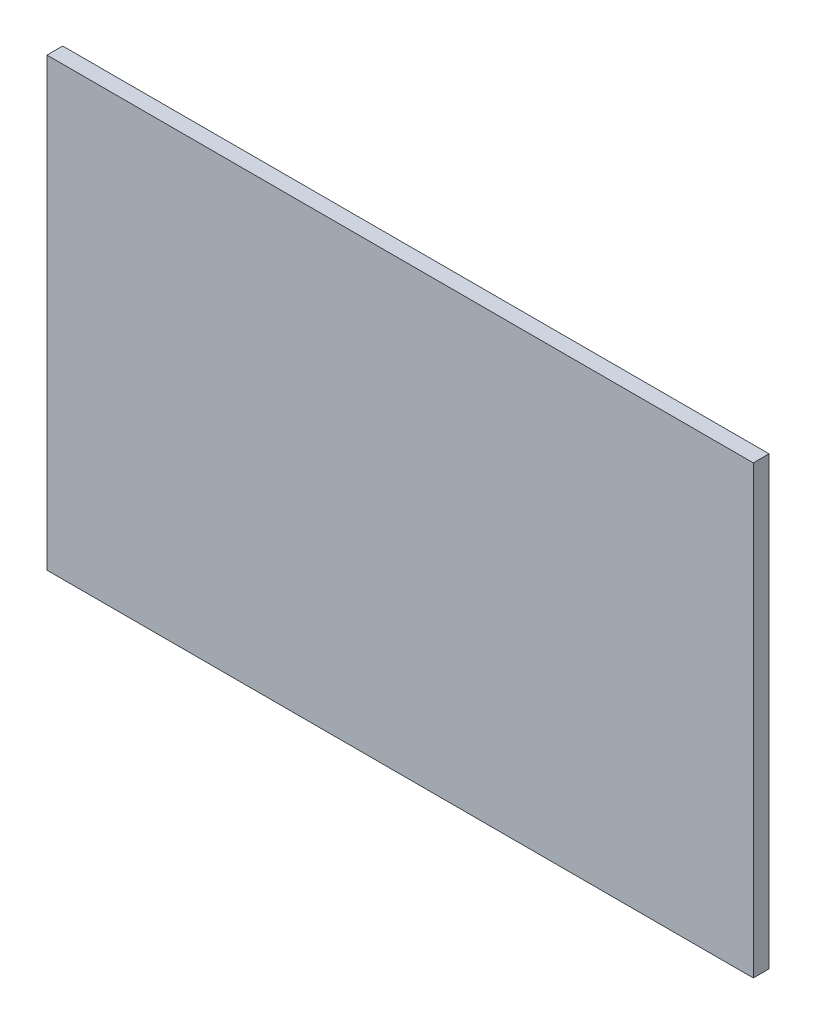
from build123d import *

# Parameters (mm, degrees)
SKETCH1_W           = 784.225
SKETCH1_H           = 495.3
BOSS_EXTRUDE1_DEPTH = 17.4625


with BuildPart() as part:
    # Sketch1 → Boss-Extrude1 (new body)
    with BuildSketch(Plane.XY):
        with Locations((392.1125, 247.65)):
            Rectangle(SKETCH1_W, SKETCH1_H)
    extrude(amount=BOSS_EXTRUDE1_DEPTH)


solid = part.part
